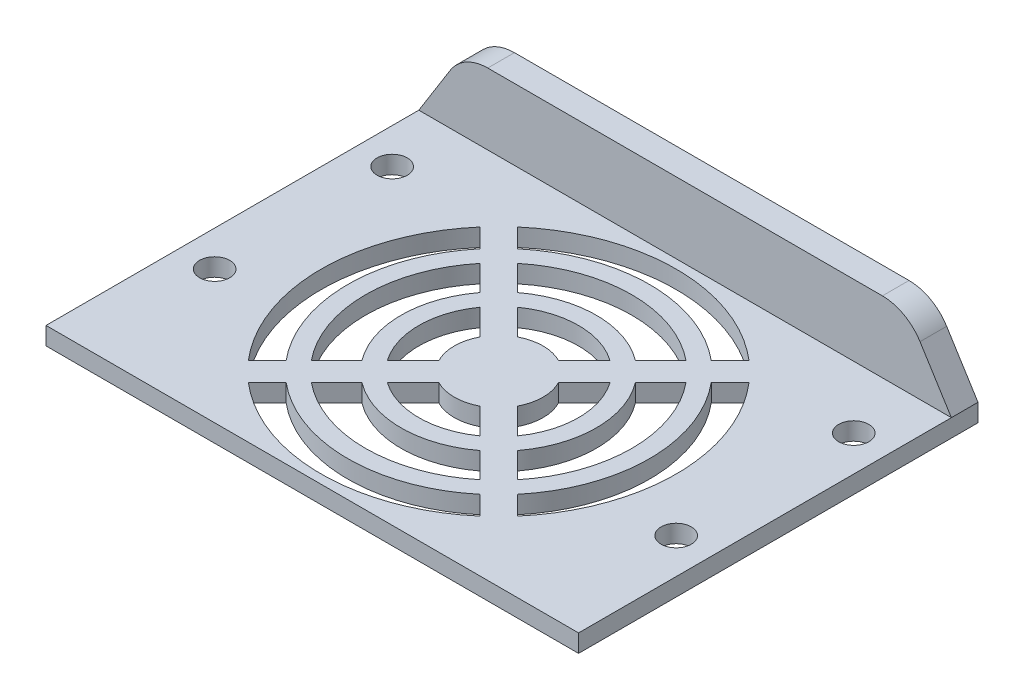
from build123d import *

# Parameters (mm, degrees)
SKETCH1_W                  = 60
SKETCH1_H                  = 45
BOSS_EXTRUDE1_DEPTH        = 2
F_3_4_3_4_DIAMETER_HOLE1_D = 3.4
SKETCH5_R                  = 2.5
AIR_HOLES_DEPTH            = 76.026661928
CIRPATTERN1_COUNT          = 4
SKETCH6_R                  = 2.5
BOSS_EXTRUDE3_DEPTH        = 2
BOSS_EXTRUDE5_DEPTH        = 3


with BuildPart() as part:
    # Sketch1 → Boss-Extrude1 (new body)
    with BuildSketch(Plane(origin=(0, 0, 0), x_dir=(1, 0, 0), z_dir=(0, 1, 0))):
        with Locations((30, 22.5)):
            Rectangle(SKETCH1_W, SKETCH1_H)
    extrude(amount=BOSS_EXTRUDE1_DEPTH)

    # Ø3.4 (3.4) Diameter Hole1 (through all)
    with Locations(Plane(origin=(0, 2, 0), x_dir=(1, 0, 0), z_dir=(0, 1, 0))):
        with Locations((4, 15), (4, 35), (56, 35), (56, 15)):
            Hole(F_3_4_3_4_DIAMETER_HOLE1_D / 2)

    # Sketch5 → Air holes (cut, through all)
    with BuildSketch(Plane(origin=(0, 2, 0), x_dir=(1, 0, 0), z_dir=(0, 1, 0))):
        with Locations(Location((30, 21, 0), (0, 0, 270))):
            Circle(SKETCH5_R)
        with BuildLine():
            Line((20.507224712, 32.614095631), (23.355142668, 29.766177675))
            ThreePointArc((23.355142668, 29.766177675), (30, 32), (36.644857332, 29.766177675))
            Line((36.644857332, 29.766177675), (39.492775288, 32.614095631))
            ThreePointArc((39.492775288, 32.614095631), (30, 36), (20.507224712, 32.614095631))
        make_face()
        with BuildLine():
            Line((24.785709973, 28.335610371), (27.687975781, 25.433344563))
            ThreePointArc((27.687975781, 25.433344563), (30, 26), (32.312024219, 25.433344563))
            Line((32.312024219, 25.433344563), (35.214290027, 28.335610371))
            ThreePointArc((35.214290027, 28.335610371), (30, 30), (24.785709973, 28.335610371))
        make_face()
        with BuildLine():
            Line((40.913269843, 34.034590187), (43.041644604, 36.162964948))
            ThreePointArc((43.041644604, 36.162964948), (30, 41), (16.958355396, 36.162964948))
            Line((16.958355396, 36.162964948), (19.086730157, 34.034590187))
            ThreePointArc((19.086730157, 34.034590187), (30, 38), (40.913269843, 34.034590187))
        make_face()
    air_holes = extrude(amount=-AIR_HOLES_DEPTH, mode=Mode.SUBTRACT)

    # CirPattern1: Air holes ×4 about axis
    cirpattern1_axis = Axis((30, 0, -21), (0, 1, 0))
    for i in range(1, CIRPATTERN1_COUNT):
        add(air_holes.rotate(cirpattern1_axis, i * 360 / CIRPATTERN1_COUNT), mode=Mode.SUBTRACT)

    # Sketch6 → Boss-Extrude3 (add)
    with BuildSketch(Plane(origin=(0, 2, 0), x_dir=(1, 0, 0), z_dir=(0, 1, 0))):
        with Locations((30, 21)):
            Circle(SKETCH6_R)
    extrude(amount=-BOSS_EXTRUDE3_DEPTH)

    # Sketch10 → Boss-Extrude5 (add)
    with BuildSketch(Plane(origin=(0, 0, -45), x_dir=(-1, 0, 0), z_dir=(0, 0, -1))):
        with BuildLine():
            Line((-60, 2), (-56.468753312, 7.6499947))
            ThreePointArc((-56.468753312, 7.6499947), (-54.652604454, 9.373212406), (-52.228761792, 10))
            Line((-52.228761792, 10), (-7.771238208, 10))
            ThreePointArc((-7.771238208, 10), (-5.347395546, 9.373212406), (-3.531246688, 7.6499947))
            Line((-3.531246688, 7.6499947), (0, 2))
            Line((0, 2), (0, 0))
            Line((0, 0), (-60, 0))
            Line((-60, 0), (-60, 2))
        make_face()
    extrude(amount=-BOSS_EXTRUDE5_DEPTH)


solid = part.part
